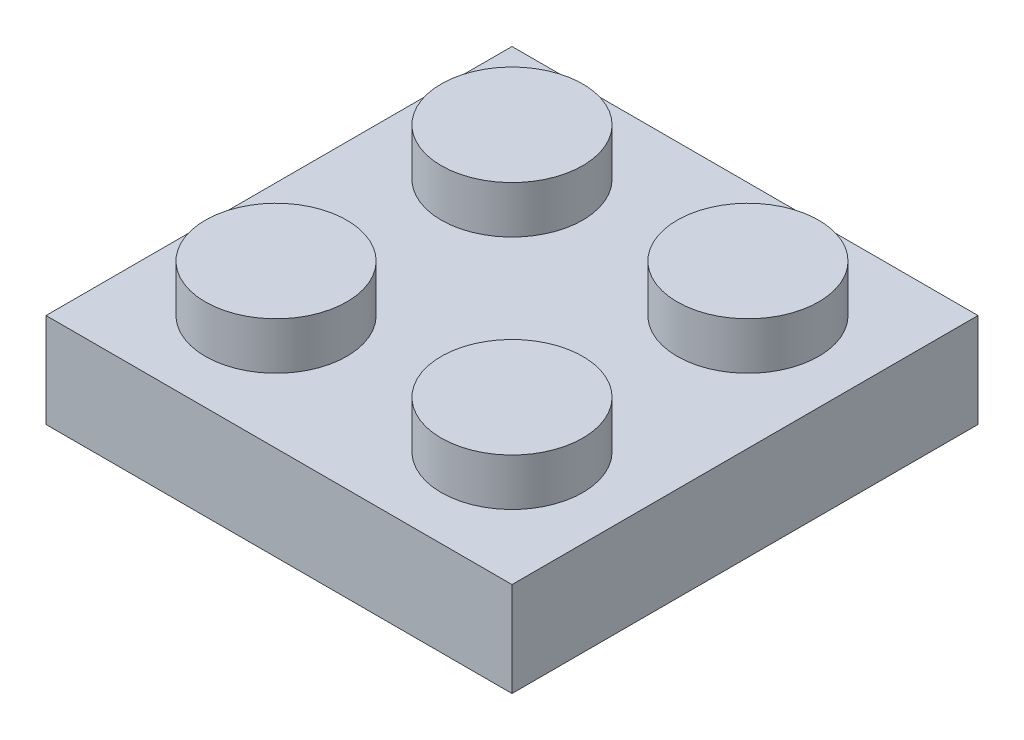
from build123d import *

# Parameters (mm, degrees)
SKETCH1_W            = 15.8
SKETCH1_H            = 3.2
BOSS_EXTRUDE1_DEPTH  = 15.8
SKETCH2_R            = 2.4
BOSS_EXTRUDE2_DEPTH  = 1.6
LPATTERN1_COUNT      = 2
LPATTERN1_PITCH      = 8
LPATTERN1_COUNT_DIR2 = 4
LPATTERN1_PITCH_DIR2 = 8
SHELL1_T             = -1.2
SKETCH4_R            = 3.25
SKETCH4_R_2          = 2.4
BOSS_EXTRUDE3_DEPTH  = 1.8


with BuildPart() as part:
    # Sketch1 → Boss-Extrude1 (new body)
    with BuildSketch(Plane.XY):
        with Locations((7.9, 1.6)):
            Rectangle(SKETCH1_W, SKETCH1_H)
    extrude(amount=-BOSS_EXTRUDE1_DEPTH)

    # Sketch2 → Boss-Extrude2 (add)
    with BuildSketch(Plane(origin=(0, 3.2, 0), x_dir=(1, 0, 0), z_dir=(0, 1, 0))):
        with Locations(Location((3.9, 3.9, 0), (0, 0, 270))):
            Circle(SKETCH2_R)
    boss_extrude2 = extrude(amount=BOSS_EXTRUDE2_DEPTH)

    # LPattern1: Boss-Extrude2 2 × 4, 4 skipped
    with Locations(*[(j * LPATTERN1_PITCH_DIR2, 0, -i * LPATTERN1_PITCH) for i in range(LPATTERN1_COUNT) for j in range(LPATTERN1_COUNT_DIR2) if (i, j) not in ((0, 0), (0, 2), (0, 3), (1, 2), (1, 3))]):
        add(boss_extrude2)

    # Shell1
    shell1_openings = [part.faces().sort_by_distance(p)[0] for p in [
        (7.9, 0, -7.9),
    ]]
    offset(amount=SHELL1_T, openings=shell1_openings, kind=Kind.INTERSECTION)

    # Sketch4 → Boss-Extrude3 (add)
    with BuildSketch(Plane.XZ.offset(-2)):
        with Locations(Location((7.9, -7.9, 0), (0, 0, 90))):
            Circle(SKETCH4_R)
        with Locations(Location((7.9, -7.9, 0), (0, 0, 270))):
            Circle(SKETCH4_R_2, mode=Mode.SUBTRACT)
    extrude(amount=BOSS_EXTRUDE3_DEPTH)


solid = part.part
